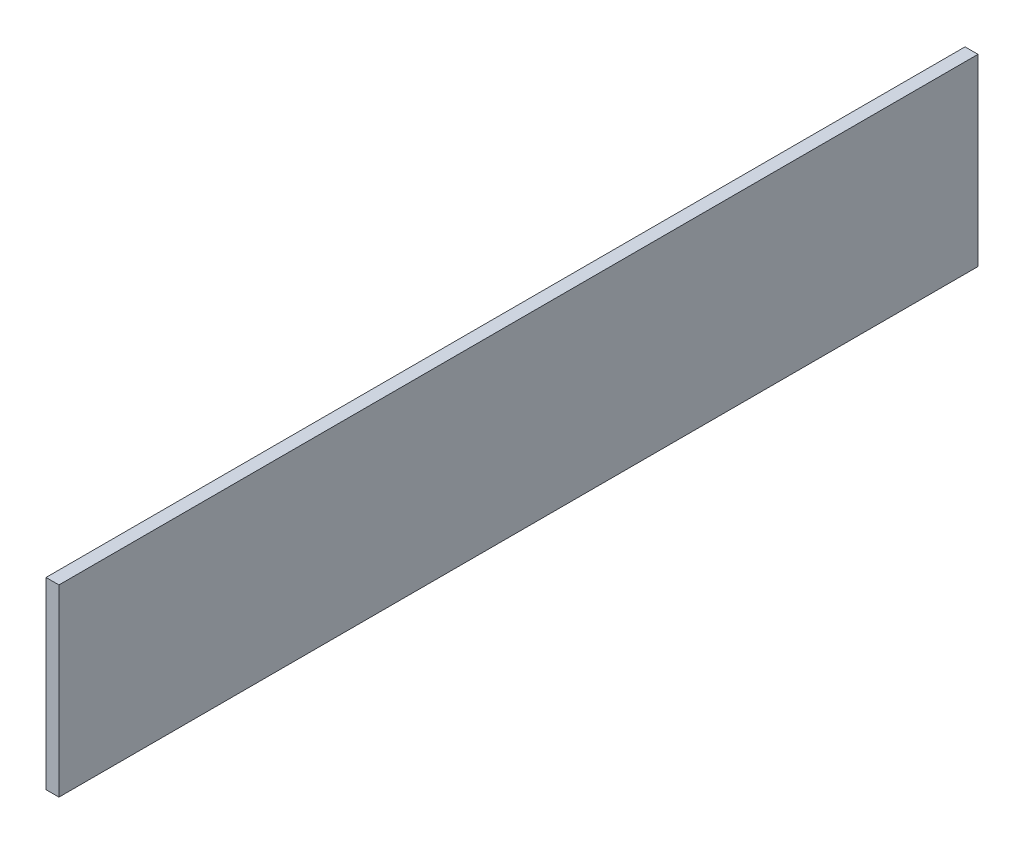
from build123d import *

# Parameters (mm, degrees)
CROQUIS1_W              = 355
CROQUIS1_H              = 71
SALIENTE_EXTRUIR1_DEPTH = 5


with BuildPart() as part:
    # Croquis1 → Saliente-Extruir1 (new body)
    with BuildSketch(Plane(origin=(0, 0, 0), x_dir=(0, 0, -1), z_dir=(1, 0, 0))):
        with Locations((89.169291339, 16.771653543)):
            Rectangle(CROQUIS1_W, CROQUIS1_H)
    extrude(amount=SALIENTE_EXTRUIR1_DEPTH)


solid = part.part
